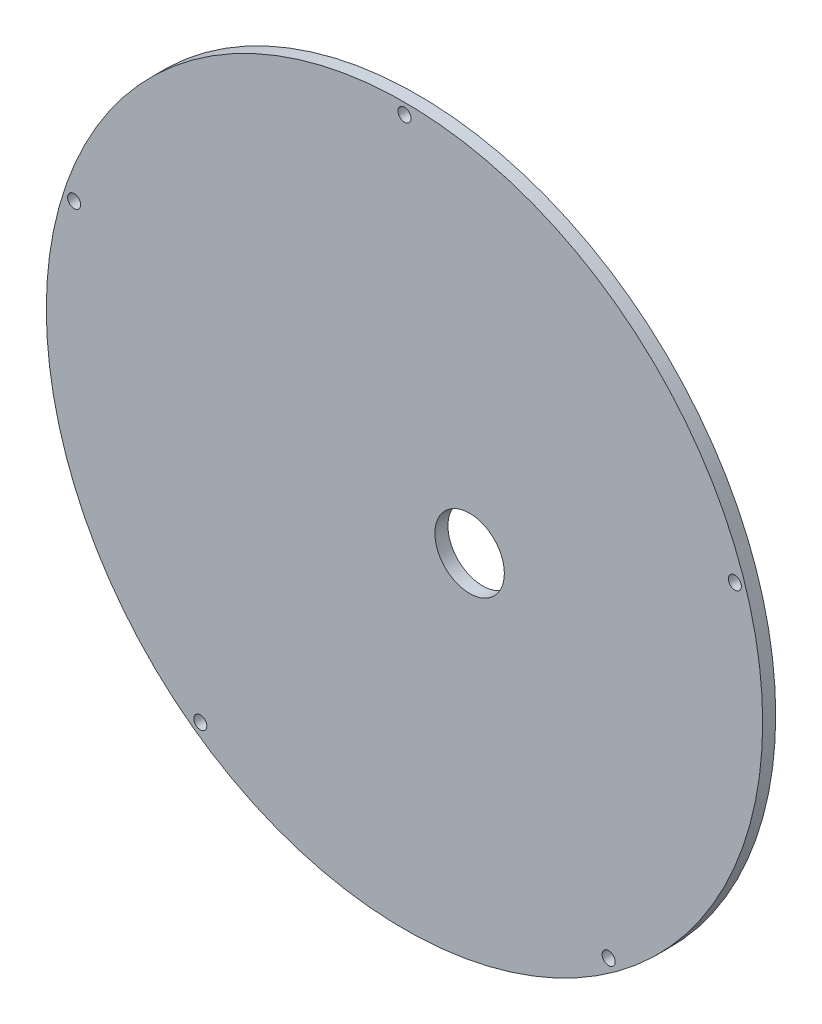
from build123d import *

# Parameters (mm, degrees)
SKETCH1_R             = 82.5
BOSS_EXTRUDE1_DEPTH   = 3
F_3_0MM_DOWEL_HOLE1_D = 3
CIRPATTERN1_COUNT     = 5
SKETCH4_R             = 8
CUT_EXTRUDE1_DEPTH    = 117.711181984


with BuildPart() as part:
    # Sketch1 → Boss-Extrude1 (new body)
    with BuildSketch(Plane.XY):
        Circle(SKETCH1_R)
    extrude(amount=BOSS_EXTRUDE1_DEPTH)

    # Ø3.0mm Dowel Hole1 (through all)
    with Locations(Plane(origin=(0, 80, 3), x_dir=(1, 0, 0), z_dir=(0, 0, 1))):
        with Locations((0, 0)):
            f_3_0mm_dowel_hole1 = Hole(F_3_0MM_DOWEL_HOLE1_D / 2)

    # CirPattern1: Ø3.0mm Dowel Hole1 ×5 about axis
    cirpattern1_axis = Axis((0, 0, 0), (0, 0, 1))
    for i in range(1, CIRPATTERN1_COUNT):
        add(f_3_0mm_dowel_hole1.rotate(cirpattern1_axis, i * 360 / CIRPATTERN1_COUNT), mode=Mode.SUBTRACT)

    # Sketch4 → Cut-Extrude1 (cut, through all)
    with BuildSketch(Plane.XY.offset(3)):
        with Locations((15, 0)):
            Circle(SKETCH4_R)
    extrude(amount=-CUT_EXTRUDE1_DEPTH, mode=Mode.SUBTRACT)


solid = part.part
